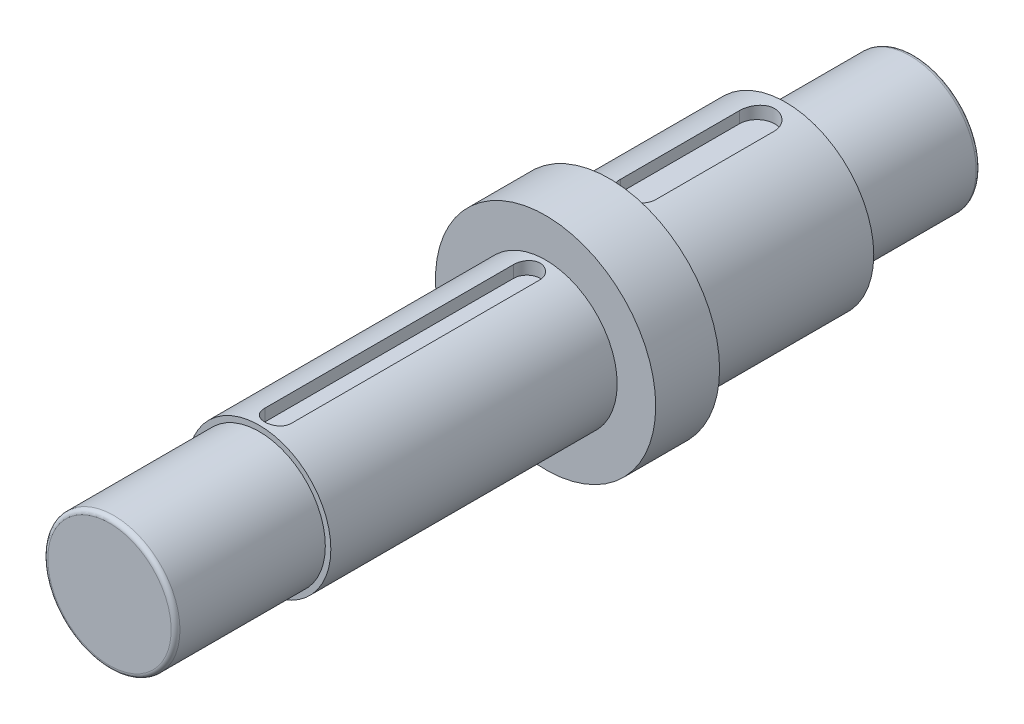
from build123d import *

# Parameters (mm, degrees)
FILLET1_R          = 2
CUT_EXTRUDE1_START = 34
CUT_EXTRUDE1_DEPTH = 10
CUT_EXTRUDE2_START = 26.5
CUT_EXTRUDE2_DEPTH = 10


with BuildPart() as part:
    # Sketch1 → Revolve1 (revolve)
    with BuildSketch(Plane(origin=(0, 0, 0), x_dir=(0, 0, -1), z_dir=(1, 0, 0)), mode=Mode.PRIVATE) as revolve1_sk:
        Polygon((0, 0), (-365.5, 0), (-365.5, 30), (-297.5, 30), (-297.5, 32.5), (-167.5, 32.5), (-167.5, 50), (-138.5, 50), (-138.5, 40), (-58.5, 40), (-58.5, 30), (0, 30), align=None)
    revolve(revolve1_sk.sketch.rotate(Axis((0, 0, 0), (0, 0, -1)), 90), axis=Axis((0, 0, 0), (0, 0, -1)))

    # Fillet1
    fillet1_edges = [part.edges().sort_by_distance(p)[0] for p in [
        (-30, 0, 365.5),
        (-30, 0, 0),
    ]]
    fillet(fillet1_edges, radius=FILLET1_R)

    # Sketch2 → Cut-Extrude1 (cut)
    with BuildSketch(Plane(origin=(0, 0, 0), x_dir=(1, 0, 0), z_dir=(0, 1, 0)).offset(CUT_EXTRUDE1_START)):
        with BuildLine():
            Line((8, -71.5), (8, -125.5))
            ThreePointArc((8, -125.5), (0, -133.5), (-8, -125.5))
            Line((-8, -125.5), (-8, -71.5))
            ThreePointArc((-8, -71.5), (0, -63.5), (8, -71.5))
        make_face()
    extrude(amount=CUT_EXTRUDE1_DEPTH, mode=Mode.SUBTRACT)

    # Sketch3 → Cut-Extrude2 (cut)
    with BuildSketch(Plane(origin=(0, 0, 0), x_dir=(1, 0, 0), z_dir=(0, 1, 0)).offset(CUT_EXTRUDE2_START)):
        with BuildLine():
            Line((6, -176), (6, -289))
            ThreePointArc((6, -289), (0, -295), (-6, -289))
            Line((-6, -289), (-6, -176))
            ThreePointArc((-6, -176), (0, -170), (6, -176))
        make_face()
    extrude(amount=CUT_EXTRUDE2_DEPTH, mode=Mode.SUBTRACT)


solid = part.part
